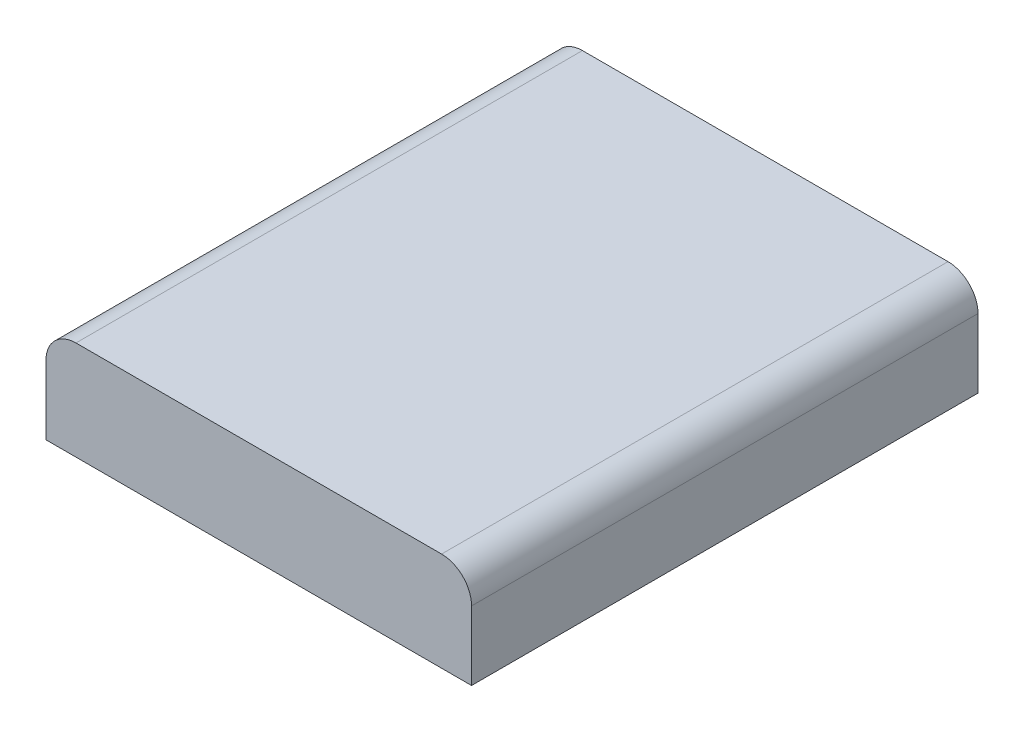
from build123d import *

# Parameters (mm, degrees)
EXTRUDE_1_DEPTH = 169


with BuildPart() as part:
    # 草图1 → 凸台-拉伸1 (new body)
    with BuildSketch(Plane.XY):
        with BuildLine():
            Line((0, 0), (142, 0))
            Line((142, 0), (142, 23))
            ThreePointArc((142, 23), (139.071067812, 30.071067812), (132, 33))
            Line((132, 33), (10, 33))
            ThreePointArc((10, 33), (2.928932188, 30.071067812), (0, 23))
            Line((0, 23), (0, 0))
        make_face()
    extrude(amount=EXTRUDE_1_DEPTH)


solid = part.part
